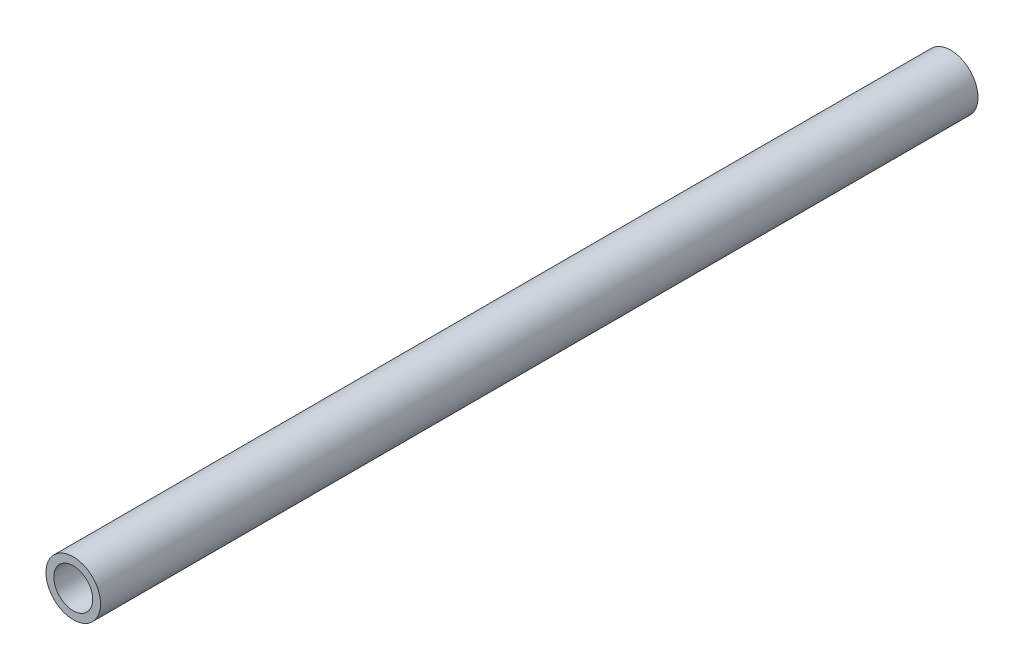
from build123d import *

# Parameters (mm, degrees)
SZKIC1_R                    = 7
SZKIC1_R_2                  = 5
DODANIE_WYCI_GNI_CIE1_DEPTH = 225


with BuildPart() as part:
    # Szkic1 → Dodanie-wyciągnięcie1 (new body)
    with BuildSketch(Plane.XY):
        Circle(SZKIC1_R)
        Circle(SZKIC1_R_2, mode=Mode.SUBTRACT)
    extrude(amount=DODANIE_WYCI_GNI_CIE1_DEPTH)


solid = part.part
